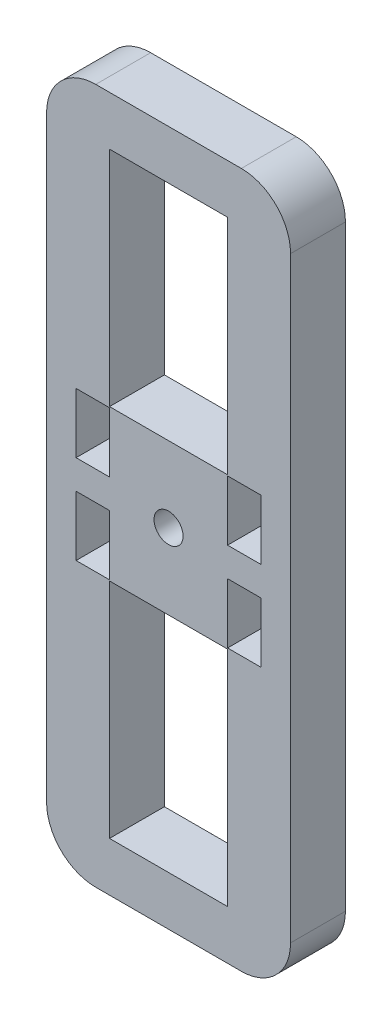
from build123d import *

# Parameters (mm, degrees)
SKETCH1_W           = 3.4
SKETCH1_H           = 6.1
SKETCH1_W_2         = 12
SKETCH1_H_2         = 22.665
SKETCH1_R           = 1.475
BOSS_EXTRUDE1_DEPTH = 5.58


with BuildPart() as part:
    # Sketch1 → Boss-Extrude1 (new body)
    with BuildSketch(Plane.XY):
        with BuildLine():
            Line((708.295729089, 432.614671907), (715.695729089, 432.614671907))
            Line((715.695729089, 432.614671907), (723.095729089, 432.614671907))
            ThreePointArc((723.095729089, 432.614671907), (726.631262995, 434.079138001), (728.095729089, 437.614671907))
            Line((728.095729089, 437.614671907), (728.095729089, 498.294671907))
            ThreePointArc((728.095729089, 498.294671907), (726.631262995, 501.830205812), (723.095729089, 503.294671907))
            Line((723.095729089, 503.294671907), (715.695729089, 503.294671907))
            Line((715.695729089, 503.294671907), (708.295729089, 503.294671907))
            ThreePointArc((708.295729089, 503.294671907), (704.760195183, 501.830205812), (703.295729089, 498.294671907))
            Line((703.295729089, 498.294671907), (703.295729089, 437.614671907))
            ThreePointArc((703.295729089, 437.614671907), (704.760195183, 434.079138001), (708.295729089, 432.614671907))
        make_face()
        with Locations((707.995729089, 463.429671907)):
            Rectangle(SKETCH1_W, SKETCH1_H, mode=Mode.SUBTRACT)
        with Locations((715.695729089, 448.947171907)):
            Rectangle(SKETCH1_W_2, SKETCH1_H_2, mode=Mode.SUBTRACT)
        with Locations((723.395729089, 463.429671907)):
            Rectangle(SKETCH1_W, SKETCH1_H, mode=Mode.SUBTRACT)
        with Locations((707.995729089, 472.479671907)):
            Rectangle(SKETCH1_W, SKETCH1_H, mode=Mode.SUBTRACT)
        with Locations((715.695729089, 467.954671907)):
            Circle(SKETCH1_R, mode=Mode.SUBTRACT)
        with Locations((723.395729089, 472.479671907)):
            Rectangle(SKETCH1_W, SKETCH1_H, mode=Mode.SUBTRACT)
        with Locations((715.695729089, 486.962171907)):
            Rectangle(SKETCH1_W_2, SKETCH1_H_2, mode=Mode.SUBTRACT)
    extrude(amount=BOSS_EXTRUDE1_DEPTH)


solid = part.part
